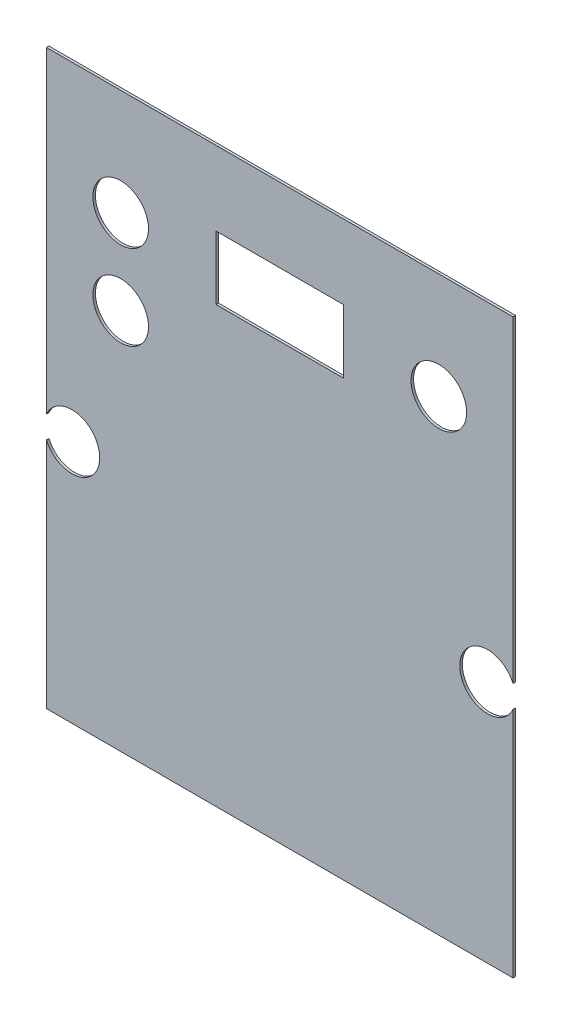
from build123d import *

# Parameters (mm, degrees)
SKETCH2_R           = 1.6637
SKETCH2_W           = 7.62
SKETCH2_H           = 3.81
BOSS_EXTRUDE1_DEPTH = 0.15


with BuildPart() as part:
    # Sketch2 → Boss-Extrude1 (new body)
    with BuildSketch(Plane.XY):
        with BuildLine():
            Line((0, 0), (27.94, 0))
            Line((27.94, 0), (27.94, 13.937675724))
            ThreePointArc((27.94, 13.937675724), (24.7523, 14.605), (27.94, 15.272324276))
            Line((27.94, 15.272324276), (27.94, 34.29))
            Line((27.94, 34.29), (0, 34.29))
            Line((0, 34.29), (0, 15.272324276))
            ThreePointArc((0, 15.272324276), (3.1877, 14.605), (0, 13.937675724))
            Line((0, 13.937675724), (0, 0))
        make_face()
        with Locations((4.445, 22.86)):
            Circle(SKETCH2_R, mode=Mode.SUBTRACT)
        with Locations((4.445, 27.94)):
            Circle(SKETCH2_R, mode=Mode.SUBTRACT)
        with Locations((23.495, 27.94)):
            Circle(SKETCH2_R, mode=Mode.SUBTRACT)
        with Locations((13.97, 27.94)):
            Rectangle(SKETCH2_W, SKETCH2_H, mode=Mode.SUBTRACT)
    extrude(amount=BOSS_EXTRUDE1_DEPTH)


solid = part.part
